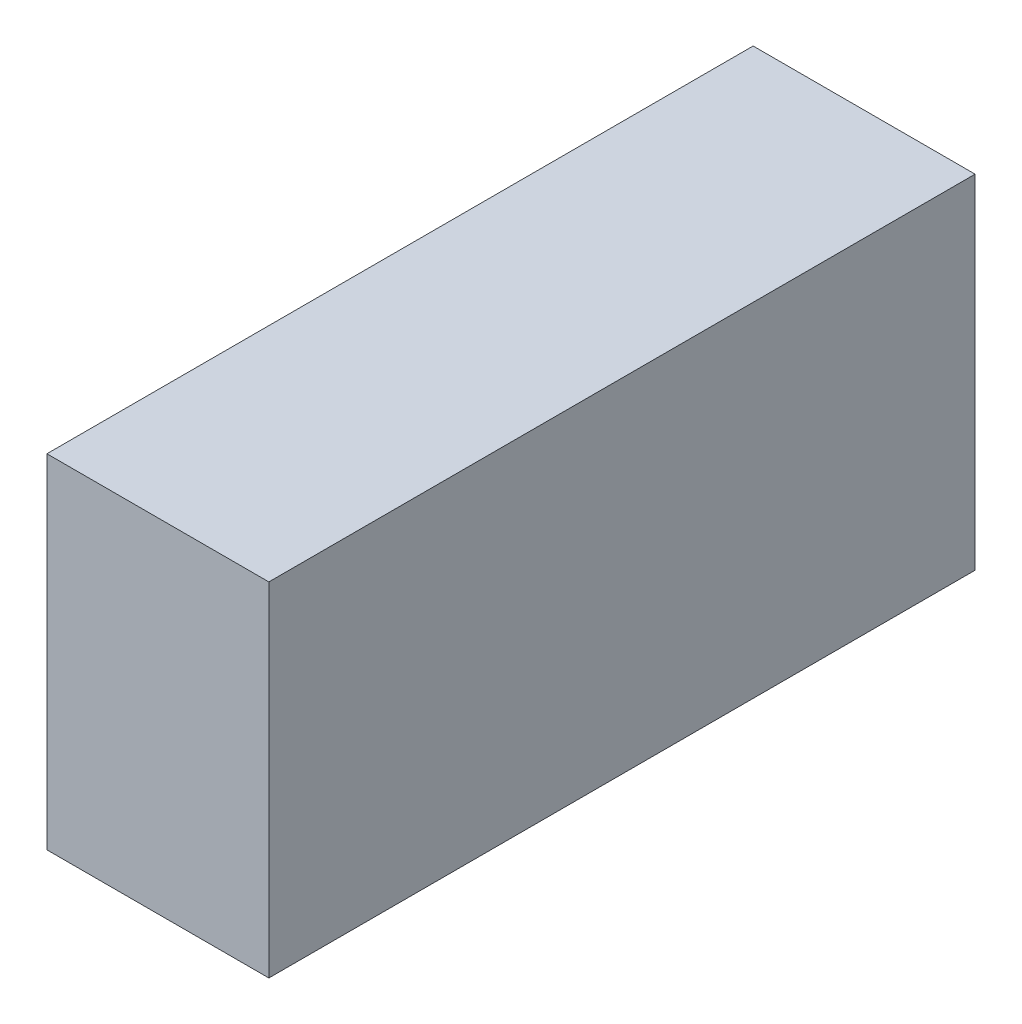
from build123d import *

# Parameters (mm, degrees)
SKETCH1_W           = 22
SKETCH1_H           = 34
BOSS_EXTRUDE1_DEPTH = 35


with BuildPart() as part:
    # Sketch1 → Boss-Extrude1 (new, symmetric)
    with BuildSketch(Plane.XY):
        Rectangle(SKETCH1_W, SKETCH1_H)
    extrude(amount=BOSS_EXTRUDE1_DEPTH, both=True)


solid = part.part
